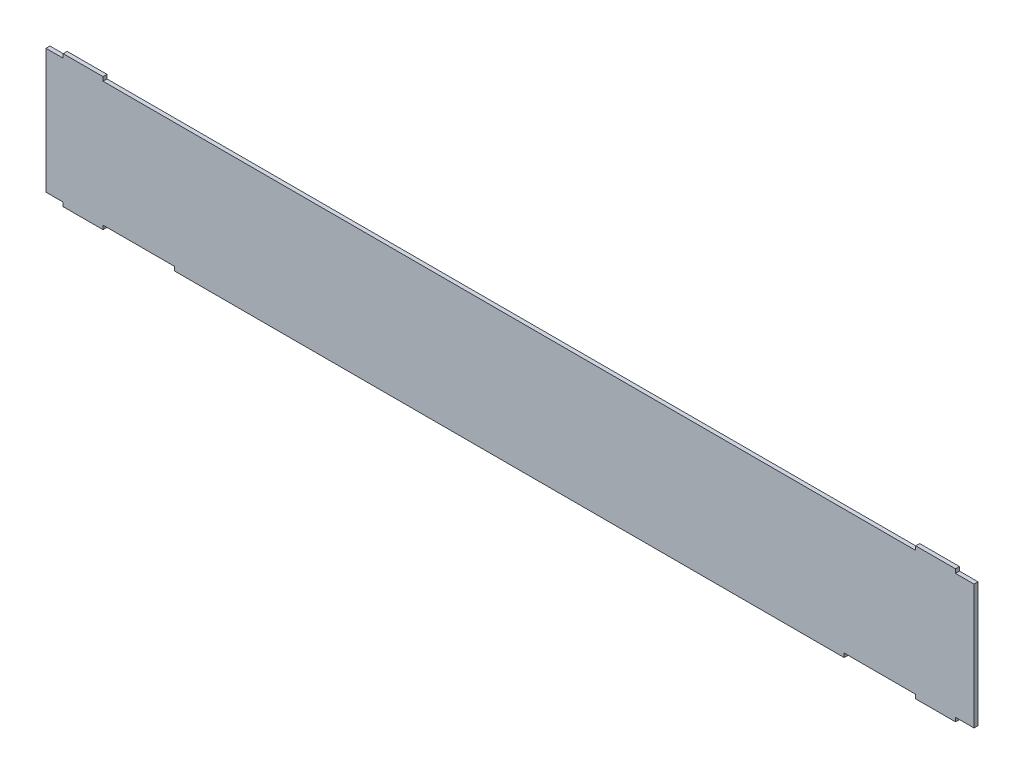
from build123d import *

# Parameters (mm, degrees)
SKETCH1_W           = 700
SKETCH1_H           = 100
BOSS_EXTRUDE1_DEPTH = 3
SKETCH11_W          = 14
SKETCH11_H          = 3
CUT_EXTRUDE8_DEPTH  = 10
SKETCH12_W          = 54
SKETCH12_H          = 3
CUT_EXTRUDE9_DEPTH  = 10
SKETCH13_W          = 13
SKETCH13_H          = 3
CUT_EXTRUDE10_DEPTH = 10
SKETCH14_W          = 54
SKETCH14_H          = 3
CUT_EXTRUDE11_DEPTH = 10
SKETCH15_W          = 14
SKETCH15_H          = 3
CUT_EXTRUDE12_DEPTH = 10
SKETCH16_W          = 54
SKETCH16_H          = 3
CUT_EXTRUDE13_DEPTH = 10
SKETCH17_W          = 13
SKETCH17_H          = 3
CUT_EXTRUDE14_DEPTH = 10
SKETCH18_W          = 54
SKETCH18_H          = 3
CUT_EXTRUDE15_DEPTH = 10
SKETCH21_W          = 505
SKETCH21_H          = 3
CUT_EXTRUDE16_DEPTH = 3


with BuildPart() as part:
    # Sketch1 → Boss-Extrude1 (new body)
    with BuildSketch(Plane.XY):
        with Locations((350, 50)):
            Rectangle(SKETCH1_W, SKETCH1_H)
    extrude(amount=BOSS_EXTRUDE1_DEPTH)

    # Sketch11 → Cut-Extrude8 (cut)
    with BuildSketch(Plane(origin=(0, 0, 0), x_dir=(-1, 0, 0), z_dir=(0, 0, -1))):
        with Locations((-693, 1.5)):
            Rectangle(SKETCH11_W, SKETCH11_H)
    extrude(amount=-CUT_EXTRUDE8_DEPTH, mode=Mode.SUBTRACT)

    # Sketch12 → Cut-Extrude9 (cut)
    with BuildSketch(Plane(origin=(0, 0, 0), x_dir=(-1, 0, 0), z_dir=(0, 0, -1))):
        with Locations((-629, 1.5)):
            Rectangle(SKETCH12_W, SKETCH12_H)
    extrude(amount=-CUT_EXTRUDE9_DEPTH, mode=Mode.SUBTRACT)

    # Sketch13 → Cut-Extrude10 (cut)
    with BuildSketch(Plane(origin=(0, 0, 0), x_dir=(-1, 0, 0), z_dir=(0, 0, -1))):
        with Locations((-6.5, 1.5)):
            Rectangle(SKETCH13_W, SKETCH13_H)
    extrude(amount=-CUT_EXTRUDE10_DEPTH, mode=Mode.SUBTRACT)

    # Sketch14 → Cut-Extrude11 (cut)
    with BuildSketch(Plane(origin=(0, 0, 0), x_dir=(-1, 0, 0), z_dir=(0, 0, -1))):
        with Locations((-70, 1.5)):
            Rectangle(SKETCH14_W, SKETCH14_H)
    extrude(amount=-CUT_EXTRUDE11_DEPTH, mode=Mode.SUBTRACT)

    # Sketch15 → Cut-Extrude12 (cut)
    with BuildSketch(Plane(origin=(0, 0, 0), x_dir=(-1, 0, 0), z_dir=(0, 0, -1))):
        with Locations((-693, 98.5)):
            Rectangle(SKETCH15_W, SKETCH15_H)
    extrude(amount=-CUT_EXTRUDE12_DEPTH, mode=Mode.SUBTRACT)

    # Sketch16 → Cut-Extrude13 (cut)
    with BuildSketch(Plane(origin=(0, 0, 0), x_dir=(-1, 0, 0), z_dir=(0, 0, -1))):
        with Locations((-629, 98.5)):
            Rectangle(SKETCH16_W, SKETCH16_H)
    extrude(amount=-CUT_EXTRUDE13_DEPTH, mode=Mode.SUBTRACT)

    # Sketch17 → Cut-Extrude14 (cut)
    with BuildSketch(Plane(origin=(0, 0, 0), x_dir=(-1, 0, 0), z_dir=(0, 0, -1))):
        with Locations((-6.5, 98.5)):
            Rectangle(SKETCH17_W, SKETCH17_H)
    extrude(amount=-CUT_EXTRUDE14_DEPTH, mode=Mode.SUBTRACT)

    # Sketch18 → Cut-Extrude15 (cut)
    with BuildSketch(Plane(origin=(0, 0, 0), x_dir=(-1, 0, 0), z_dir=(0, 0, -1))):
        with Locations((-70, 98.5)):
            Rectangle(SKETCH18_W, SKETCH18_H)
    extrude(amount=-CUT_EXTRUDE15_DEPTH, mode=Mode.SUBTRACT)

    # Sketch21 → Cut-Extrude16 (cut)
    with BuildSketch(Plane.XY.offset(3)):
        with Locations((349.5, 98.5)):
            Rectangle(SKETCH21_W, SKETCH21_H)
    extrude(amount=-CUT_EXTRUDE16_DEPTH, mode=Mode.SUBTRACT)


solid = part.part
